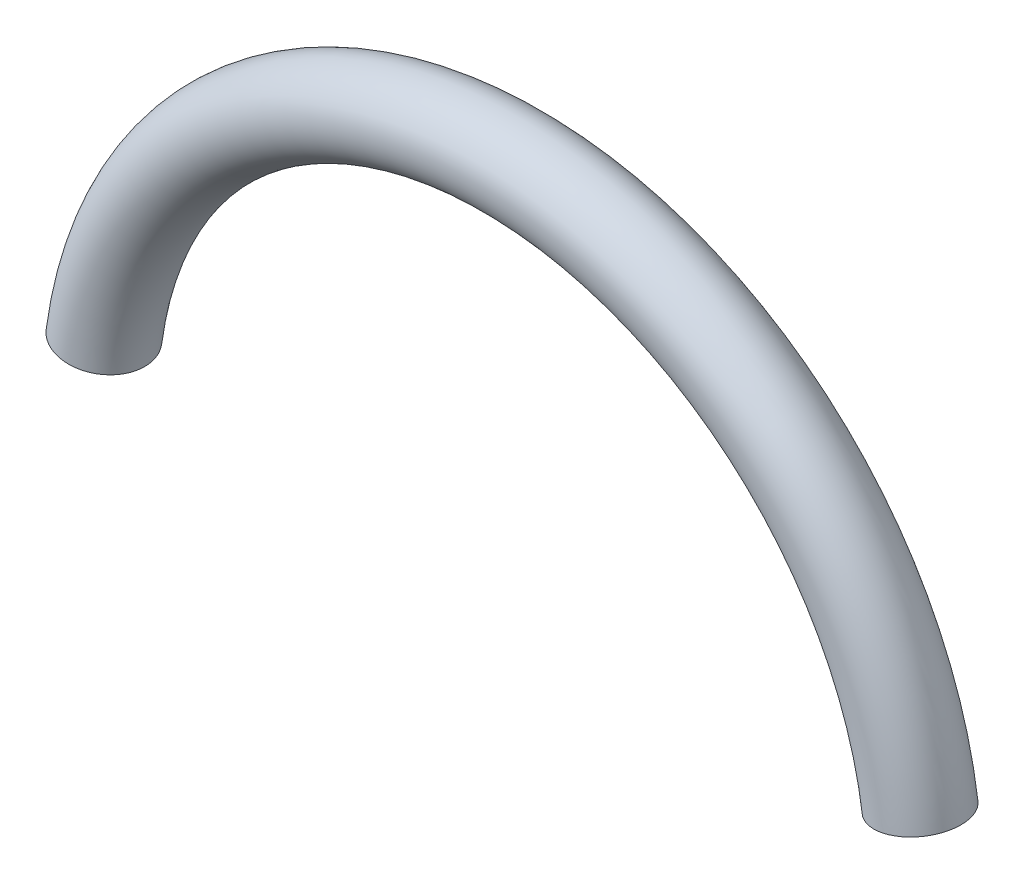
from build123d import *

# Parameters (mm, degrees)
SWEEP1_PROFILE_R = 3.175


with BuildPart() as part:
    # Sweep1: sweep along a curve in space
    with BuildLine() as sweep1_path:
        ThreePointArc((-76.862625, 112.559034405, 219.8250001), (-45.407000004, 139.995549026, 219.8250001), (-13.951375008, 112.559034405, 219.8250001))
    # Sweep1 profile (on start of the path) → Sweep1 (sweep)
    with BuildSketch(Plane(origin=(-76.862625, 112.559034405, 219.8250001), x_dir=(0.9907283463307061, -0.1358578071986462, 0), z_dir=(0.1358578071986462, 0.9907283463307061, 7.431141764645603e-14))):
        Circle(SWEEP1_PROFILE_R)
    sweep(path=sweep1_path.line)


solid = part.part
